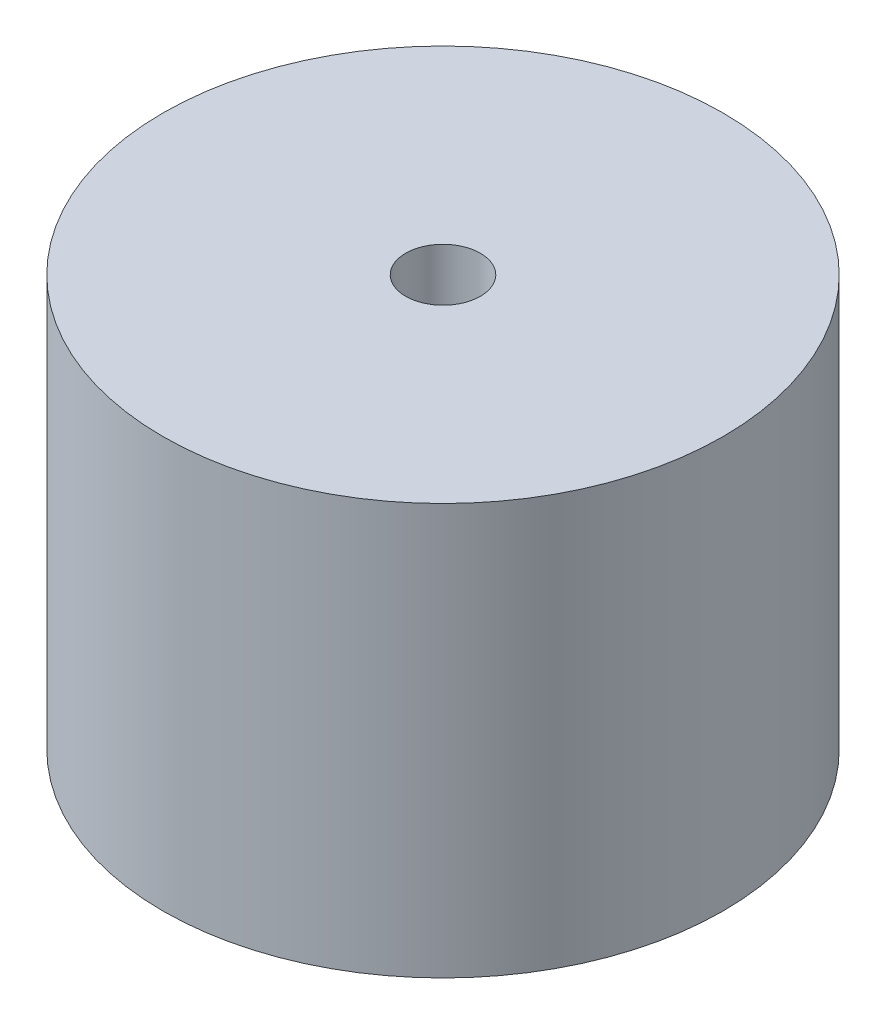
from build123d import *

# Parameters (mm, degrees)
SKETCH1_R           = 15
BOSS_EXTRUDE1_DEPTH = 22
SKETCH2_R           = 2
CUT_EXTRUDE1_DEPTH  = 5


with BuildPart() as part:
    # Sketch1 → Boss-Extrude1 (new body)
    with BuildSketch(Plane(origin=(0, 0, 0), x_dir=(1, 0, 0), z_dir=(0, 1, 0))):
        with Locations(Location((0, 0, 0), (0, 0, 270))):
            Circle(SKETCH1_R)
    extrude(amount=BOSS_EXTRUDE1_DEPTH)

    # Sketch2 → Cut-Extrude1 (cut)
    with BuildSketch(Plane(origin=(0, 22, 0), x_dir=(1, 0, 0), z_dir=(0, 1, 0))):
        with Locations(Location((0, 0, 0), (0, 0, 270))):
            Circle(SKETCH2_R)
    extrude(amount=-CUT_EXTRUDE1_DEPTH, mode=Mode.SUBTRACT)


solid = part.part
